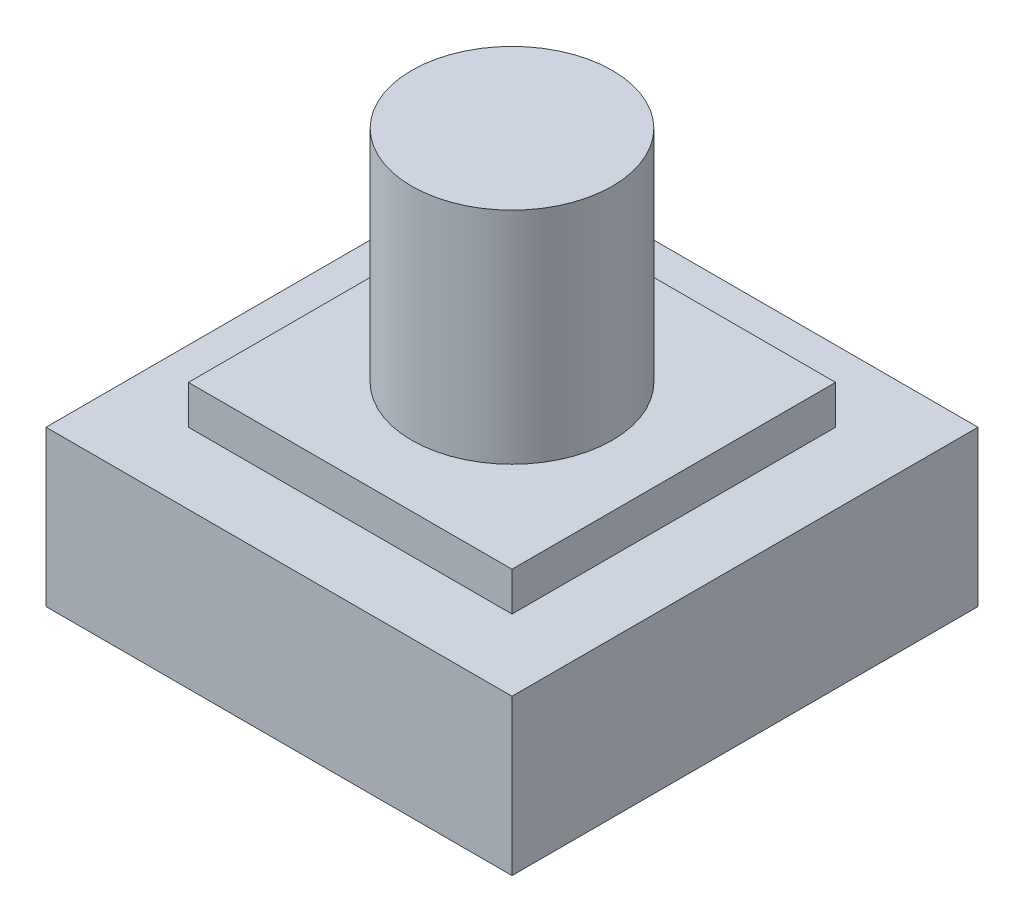
from build123d import *

# Parameters (mm, degrees)
SKETCH_1_W      = 36
SKETCH_1_H      = 36
SKETCH_1_W_2    = 25
SKETCH_1_H_2    = 25
SKETCH_1_R      = 7.75
EXTRUDE_2_DEPTH = 12
EXTRUDE_START   = 12
SKETCH_1_3_W    = 25
SKETCH_1_3_H    = 25
SKETCH_1_3_R    = 7.75
EXTRUDE_3_DEPTH = 3
EXTRUDE_START_2 = 15
SKETCH_1_5_R    = 7.75
EXTRUDE_4_DEPTH = 17
SKETCH_2_W      = 9
SKETCH_2_H      = 4.7
EXTRUDE_5_DEPTH = 2


with BuildPart() as part:
    # 草图1 → 凸台-拉伸2 (new body)
    # profile 1 of 3: a face of its own
    with BuildSketch(Plane(origin=(0, 0, 0), x_dir=(1, 0, 0), z_dir=(0, 1, 0))):
        Rectangle(SKETCH_1_W, SKETCH_1_H)
        Rectangle(SKETCH_1_W_2, SKETCH_1_H_2, mode=Mode.SUBTRACT)
    # profile 2 of 3: a face of its own
    with BuildSketch(Plane(origin=(0, 0, 0), x_dir=(1, 0, 0), z_dir=(0, 1, 0))):
        Rectangle(SKETCH_1_W_2, SKETCH_1_H_2)
        Circle(SKETCH_1_R, mode=Mode.SUBTRACT)
    # profile 3 of 3: a face of its own
    with BuildSketch(Plane(origin=(0, 0, 0), x_dir=(1, 0, 0), z_dir=(0, 1, 0))):
        Circle(SKETCH_1_R)
    extrude(amount=EXTRUDE_2_DEPTH)

    # 草图1<3> → 凸台-拉伸3 (add)
    # profile 1 of 2: a face of its own
    with BuildSketch(Plane(origin=(0, 0, 0), x_dir=(1, 0, 0), z_dir=(0, 1, 0)).offset(EXTRUDE_START)):
        Rectangle(SKETCH_1_3_W, SKETCH_1_3_H)
        Circle(SKETCH_1_3_R, mode=Mode.SUBTRACT)
    # profile 2 of 2: a face of its own
    with BuildSketch(Plane(origin=(0, 0, 0), x_dir=(1, 0, 0), z_dir=(0, 1, 0)).offset(EXTRUDE_START)):
        Circle(SKETCH_1_3_R)
    extrude(amount=EXTRUDE_3_DEPTH)

    # 草图2 → 凸台-拉伸5 (add)
    with BuildSketch(Plane.XZ):
        with Locations((7.5, -14.15)):
            Rectangle(SKETCH_2_W, SKETCH_2_H)
    extrude(amount=EXTRUDE_5_DEPTH)


with BuildPart() as body_2:
    # 草图1<5> → 凸台-拉伸4 (new body)
    with BuildSketch(Plane(origin=(0, 0, 0), x_dir=(1, 0, 0), z_dir=(0, 1, 0)).offset(EXTRUDE_START_2)):
        with Locations(Location((0, 0, 0), (0, 0, 90))):
            Circle(SKETCH_1_5_R)
    extrude(amount=EXTRUDE_4_DEPTH)


solid = Compound([part.part, body_2.part])
